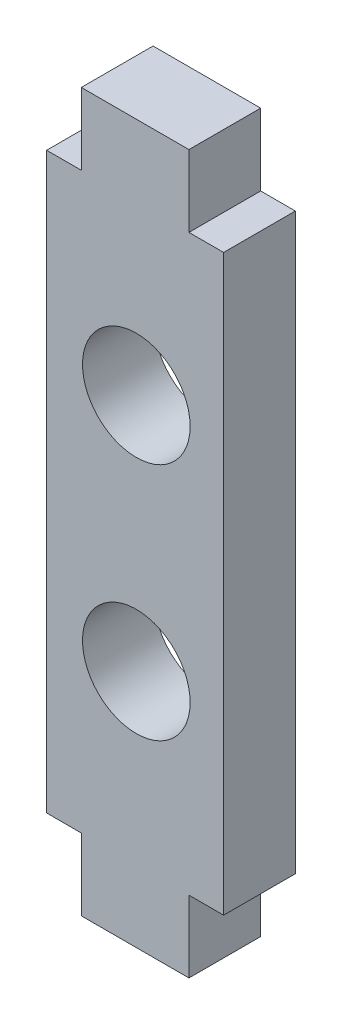
from build123d import *

# Parameters (mm, degrees)
SKETCH_1_R      = 2.25
EXTRUDE_2_DEPTH = 3


with BuildPart() as part:
    # ｽｹｯﾁ1 → ﾎﾞｽ - 押し出し2 (new body)
    with BuildSketch(Plane.XY):
        Polygon((0, 0), (0, 7), (1.45, 7), (1.45, 10), (5.95, 10), (5.95, 7), (7.4, 7), (7.4, 0), (7.4, -17), (5.95, -17), (5.95, -20), (1.45, -20), (1.45, -17), (0, -17), align=None)
        with Locations((3.75, 0)):
            Circle(SKETCH_1_R, mode=Mode.SUBTRACT)
        with Locations((3.75, -10)):
            Circle(SKETCH_1_R, mode=Mode.SUBTRACT)
    extrude(amount=EXTRUDE_2_DEPTH)


solid = part.part
